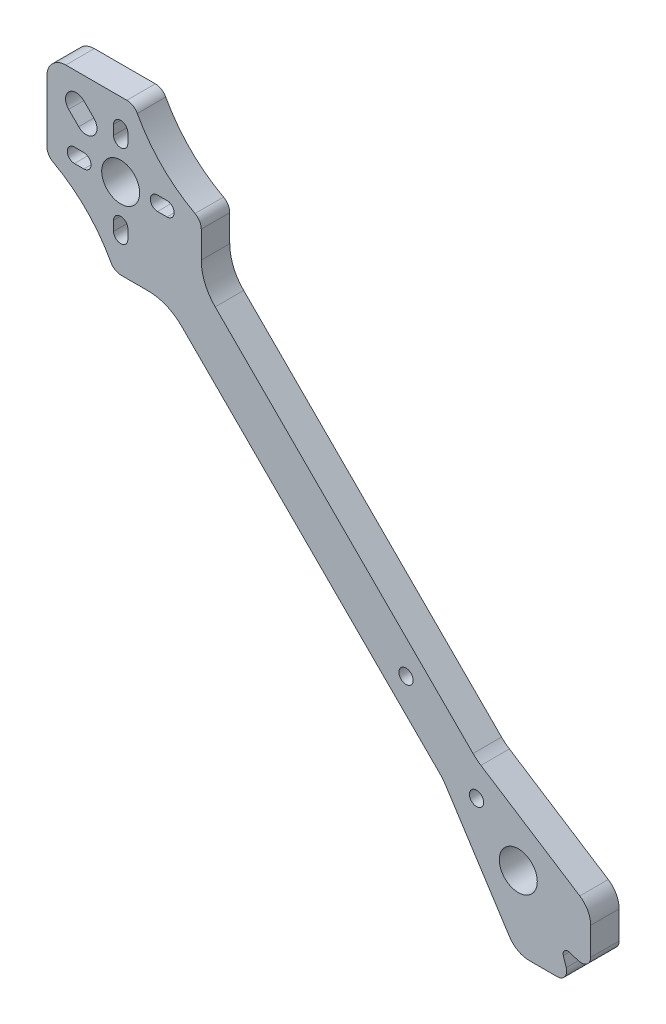
from build123d import *

# Parameters (mm, degrees)
CROQUIS1_R              = 1.5
CROQUIS1_R_2            = 4
SALIENTE_EXTRUIR1_DEPTH = 6
CROQUIS4_R              = 4
SALIENTE_EXTRUIR3_DEPTH = 6
CORTAR_EXTRUIR1_DEPTH   = 6
REDONDEO3_R             = 4
CORTAR_EXTRUIR2_DEPTH   = 6
REDONDEO4_R             = 2.5
REDONDEO6_R             = 10


with BuildPart() as part:
    # Croquis1 → Saliente-Extruir1 (new body)
    with BuildSketch(Plane.XY):
        with BuildLine():
            Line((-17.112213819, 2.294275414), (-30.516043414, 23.123582692))
            ThreePointArc((-30.516043414, 23.123582692), (-31.14080226, 23.989156666), (-31.854269143, 24.783201331))
            Line((-31.854269143, 24.783201331), (-45.961940777, 38.890872965))
            Line((-45.961940777, 38.890872965), (-89.09545443, 82.024386618))
            Line((-89.09545443, 82.024386618), (-82.024386618, 89.09545443))
            Line((-82.024386618, 89.09545443), (-38.890872965, 45.961940777))
            Line((-38.890872965, 45.961940777), (-24.783201331, 31.854269143))
            ThreePointArc((-24.783201331, 31.854269143), (-23.989156666, 31.14080226), (-23.123582692, 30.516043414))
            Line((-23.123582692, 30.516043414), (-2.294275414, 17.112213819))
            ThreePointArc((-2.294275414, 17.112213819), (-0.610887166, 15.302496804), (0, 12.907567049))
            Line((0, 12.907567049), (0, 7.055686841))
            ThreePointArc((0, 7.055686841), (-0.823113423, 5.438609853), (-2.614937985, 5.15257064))
            Line((-2.614937985, 5.15257064), (-4.503911831, 5.762938925))
            ThreePointArc((-4.503911831, 5.762938925), (-5.518487605, 5.518487605), (-5.762938925, 4.503911831))
            Line((-5.762938925, 4.503911831), (-5.15257064, 2.614937985))
            ThreePointArc((-5.15257064, 2.614937985), (-5.438609853, 0.823113423), (-7.055686841, 0))
            Line((-7.055686841, 0), (-12.907567049, 0))
            ThreePointArc((-12.907567049, 0), (-15.302496804, 0.610887166), (-17.112213819, 2.294275414))
        make_face()
        with Locations((-38.890872965, 38.890872965)):
            Circle(CROQUIS1_R, mode=Mode.SUBTRACT)
        with Locations((-24.04163056, 24.04163056)):
            Circle(CROQUIS1_R, mode=Mode.SUBTRACT)
        with Locations((-15.25, 15.25)):
            Circle(CROQUIS1_R_2, mode=Mode.SUBTRACT)
    extrude(amount=SALIENTE_EXTRUIR1_DEPTH)

    # Croquis4 → Saliente-Extruir3 (add)
    with BuildSketch(Plane.XY.offset(6)):
        Polygon((-89.09545443, 82.024386618), (-100.409162928, 82.024386618), (-114.551298552, 96.166522241), (-114.551298552, 114.551298552), (-96.166522241, 114.551298552), (-82.024386618, 100.409162928), (-82.024386618, 89.09545443), align=None)
        with Locations((-98.994949366, 98.994949366)):
            Circle(CROQUIS4_R, mode=Mode.SUBTRACT)
    extrude(amount=-SALIENTE_EXTRUIR3_DEPTH)

    # Croquis5 → Cortar-Extruir1 (cut)
    with BuildSketch(Plane.XY.offset(6)):
        with BuildLine():
            Line((-109.955104475, 106.773123959), (-107.833784131, 104.651803616))
            ThreePointArc((-107.833784131, 104.651803616), (-104.651803616, 104.651803616), (-104.651803616, 107.833784131))
            Line((-104.651803616, 107.833784131), (-106.773123959, 109.955104475))
            ThreePointArc((-106.773123959, 109.955104475), (-109.955104475, 109.955104475), (-109.955104475, 106.773123959))
        make_face()
        with BuildLine():
            Line((-100.494949366, 91.244949366), (-100.494949366, 89.244949366))
            ThreePointArc((-100.494949366, 89.244949366), (-98.994949366, 87.744949366), (-97.494949366, 89.244949366))
            Line((-97.494949366, 89.244949366), (-97.494949366, 91.244949366))
            ThreePointArc((-97.494949366, 91.244949366), (-98.994949366, 92.744949366), (-100.494949366, 91.244949366))
        make_face()
        with BuildLine():
            Line((-91.244949366, 97.494949366), (-89.244949366, 97.494949366))
            ThreePointArc((-89.244949366, 97.494949366), (-87.744949366, 98.994949366), (-89.244949366, 100.494949366))
            Line((-89.244949366, 100.494949366), (-91.244949366, 100.494949366))
            ThreePointArc((-91.244949366, 100.494949366), (-92.744949366, 98.994949366), (-91.244949366, 97.494949366))
        make_face()
        with BuildLine():
            Line((-106.744949366, 100.494949366), (-108.744949366, 100.494949366))
            ThreePointArc((-108.744949366, 100.494949366), (-110.244949366, 98.994949366), (-108.744949366, 97.494949366))
            Line((-108.744949366, 97.494949366), (-106.744949366, 97.494949366))
            ThreePointArc((-106.744949366, 97.494949366), (-105.244949366, 98.994949366), (-106.744949366, 100.494949366))
        make_face()
        with BuildLine():
            Line((-97.494949366, 106.744949366), (-97.494949366, 108.744949366))
            ThreePointArc((-97.494949366, 108.744949366), (-98.994949366, 110.244949366), (-100.494949366, 108.744949366))
            Line((-100.494949366, 108.744949366), (-100.494949366, 106.744949366))
            ThreePointArc((-100.494949366, 106.744949366), (-98.994949366, 105.244949366), (-97.494949366, 106.744949366))
        make_face()
    extrude(amount=-CORTAR_EXTRUIR1_DEPTH, mode=Mode.SUBTRACT)

    # Redondeo3
    redondeo3_edges = [part.edges().sort_by_distance(p)[0] for p in [
        (-114.551298552, 114.551298552, 3),
    ]]
    fillet(redondeo3_edges, radius=REDONDEO3_R)

    # Croquis7 → Cortar-Extruir2 (cut)
    with BuildSketch(Plane.XY.offset(6)):
        with BuildLine():
            Line((-114.551298552, 96.166522241), (-100.409162928, 82.024386618))
            ThreePointArc((-100.409162928, 82.024386618), (-106.267027305, 90.308657865), (-114.551298552, 96.166522241))
        make_face()
        with BuildLine():
            Line((-96.166522241, 114.551298552), (-82.024386618, 100.409162928))
            ThreePointArc((-82.024386618, 100.409162928), (-90.308657865, 106.267027305), (-96.166522241, 114.551298552))
        make_face()
    extrude(amount=-CORTAR_EXTRUIR2_DEPTH, mode=Mode.SUBTRACT)

    # Redondeo4
    redondeo4_edges = [part.edges().sort_by_distance(p)[0] for p in [
        (-100.409162928, 82.024386618, 3),
        (-114.551298552, 96.166522241, 3),
        (-96.166522241, 114.551298552, 3),
        (-82.024386618, 100.409162928, 3),
    ]]
    fillet(redondeo4_edges, radius=REDONDEO4_R)

    # Redondeo6
    redondeo6_edges = [part.edges().sort_by_distance(p)[0] for p in [
        (-89.09545443, 82.024386618, 3),
        (-82.024386618, 89.09545443, 3),
    ]]
    fillet(redondeo6_edges, radius=REDONDEO6_R)


solid = part.part
